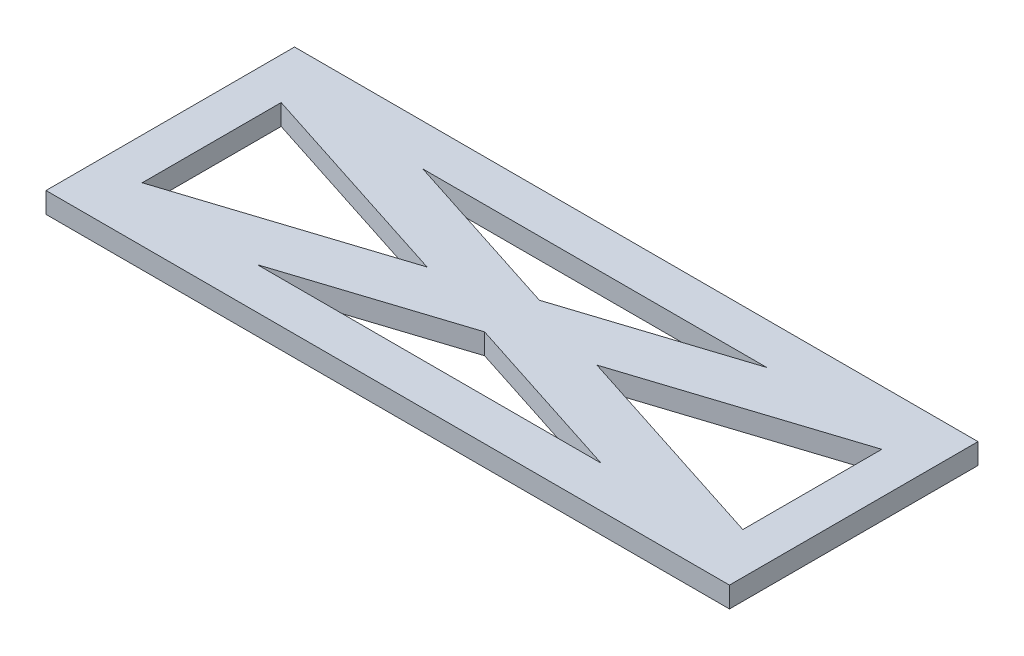
from build123d import *

# Parameters (mm, degrees)
SKETCH1_W           = 165
SKETCH1_H           = 60
BOSS_EXTRUDE1_DEPTH = 5


with BuildPart() as part:
    # Sketch1 → Boss-Extrude1 (new body)
    with BuildSketch(Plane(origin=(0, 0, 0), x_dir=(1, 0, 0), z_dir=(0, 1, 0))):
        Rectangle(SKETCH1_W, SKETCH1_H)
        Polygon((-72.5, 16.774193548), (-20.5, 0), (-72.5, -16.774193548), align=None, mode=Mode.SUBTRACT)
        Polygon((-41.5, 19.999999898), (0, 6.612903124), (41.5, 19.999999898), align=None, mode=Mode.SUBTRACT)
        Polygon((72.5, 16.774193548), (20.5, 0), (72.5, -16.774193548), align=None, mode=Mode.SUBTRACT)
        Polygon((0, -6.612903124), (41.5, -19.999999898), (-41.5, -19.999999898), align=None, mode=Mode.SUBTRACT)
    extrude(amount=BOSS_EXTRUDE1_DEPTH)


solid = part.part
